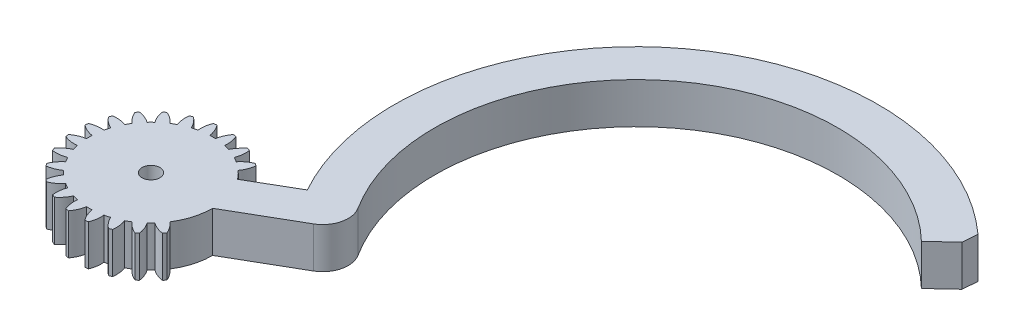
from build123d import *

# Parameters (mm, degrees)
CROQUIS1_R              = 1.75
SALIENTE_EXTRUIR1_DEPTH = 8


with BuildPart() as part:
    # Croquis1 → Saliente-Extruir1 (new body)
    with BuildSketch(Plane(origin=(0, 0, 0), x_dir=(1, 0, 0), z_dir=(0, 1, 0))):
        with BuildLine():
            ThreePointArc((26.318983455, 14.228225469), (34.708358258, 66.001642936), (87.111019212, 63.804032696))
            Line((87.111019212, 63.804032696), (91.223264764, 67.638763711))
            Line((91.223264764, 67.638763711), (91.448573923, 70.544764206))
            ThreePointArc((91.448573923, 70.544764206), (30.189185372, 72.489467715), (18.249404228, 12.373445028))
            Line((18.249404228, 12.373445028), (9.60277667, 7.349917196))
            ThreePointArc((9.60277667, 7.349917196), (8.915528014, 8.169942644), (8.158486898, 8.926012217))
            ThreePointArc((8.158486898, 8.926012217), (8.809805691, 10.105820521), (9.148703928, 11.410163953))
            ThreePointArc((9.148703928, 11.410163953), (8.903135899, 11.602792602), (8.65351323, 11.79013714))
            ThreePointArc((8.65351323, 11.79013714), (7.48132754, 11.125197659), (6.510293938, 10.190715157))
            ThreePointArc((6.510293938, 10.190715157), (6.046375, 10.472628702), (5.57027124, 10.733437515))
            ThreePointArc((5.57027124, 10.733437515), (5.894040025, 12.041618533), (5.883801663, 13.389230859))
            ThreePointArc((5.883801663, 13.389230859), (5.596745198, 13.511738163), (5.30713988, 13.62809199))
            ThreePointArc((5.30713988, 13.62809199), (4.382711316, 12.654251603), (3.650909885, 11.528463019))
            ThreePointArc((3.650909885, 11.528463019), (3.129834008, 11.680699536), (2.602450802, 11.809396783))
            ThreePointArc((2.602450802, 11.809396783), (2.576605271, 13.156800143), (2.217928037, 14.455843809))
            ThreePointArc((2.217928037, 14.455843809), (1.908945561, 14.499881098), (1.599093719, 14.537314892))
            ThreePointArc((1.599093719, 14.537314892), (0.916420874, 13.375367565), (0.542722358, 12.080565177))
            ThreePointArc((0.542722358, 12.080565177), (0, 12.09275), (-0.542722358, 12.080565177))
            ThreePointArc((-0.542722358, 12.080565177), (-0.916420874, 13.375367565), (-1.599093719, 14.537314892))
            ThreePointArc((-1.599093719, 14.537314892), (-1.908945561, 14.499881098), (-2.217928037, 14.455843809))
            ThreePointArc((-2.217928037, 14.455843809), (-2.576605271, 13.156800143), (-2.602450802, 11.809396783))
            ThreePointArc((-2.602450802, 11.809396783), (-3.129834008, 11.680699536), (-3.650909885, 11.528463019))
            ThreePointArc((-3.650909885, 11.528463019), (-4.346994451, 12.682425791), (-5.30713988, 13.62809199))
            ThreePointArc((-5.30713988, 13.62809199), (-5.596745198, 13.511738163), (-5.883801663, 13.389230859))
            ThreePointArc((-5.883801663, 13.389230859), (-5.894040025, 12.041618533), (-5.57027124, 10.733437515))
            ThreePointArc((-5.57027124, 10.733437515), (-6.046375, 10.472628702), (-6.510293938, 10.190715157))
            ThreePointArc((-6.510293938, 10.190715157), (-7.48132754, 11.125197659), (-8.65351323, 11.79013714))
            ThreePointArc((-8.65351323, 11.79013714), (-8.903135899, 11.602792602), (-9.148703928, 11.410163953))
            ThreePointArc((-9.148703928, 11.410163953), (-8.809805691, 10.105820521), (-8.158486898, 8.926012217))
            ThreePointArc((-8.158486898, 8.926012217), (-8.550865528, 8.550865528), (-8.926012217, 8.158486898))
            ThreePointArc((-8.926012217, 8.158486898), (-10.105820521, 8.809805691), (-11.410163953, 9.148703928))
            ThreePointArc((-11.410163953, 9.148703928), (-11.602792602, 8.903135899), (-11.79013714, 8.65351323))
            ThreePointArc((-11.79013714, 8.65351323), (-11.125197659, 7.48132754), (-10.190715157, 6.510293938))
            ThreePointArc((-10.190715157, 6.510293938), (-10.472628702, 6.046375), (-10.733437515, 5.57027124))
            ThreePointArc((-10.733437515, 5.57027124), (-12.041618533, 5.894040025), (-13.389230859, 5.883801663))
            ThreePointArc((-13.389230859, 5.883801663), (-13.511738163, 5.596745198), (-13.62809199, 5.30713988))
            ThreePointArc((-13.62809199, 5.30713988), (-12.682425791, 4.346994451), (-11.528463019, 3.650909885))
            ThreePointArc((-11.528463019, 3.650909885), (-11.680699536, 3.129834008), (-11.809396783, 2.602450802))
            ThreePointArc((-11.809396783, 2.602450802), (-13.156800143, 2.576605271), (-14.455843809, 2.217928037))
            ThreePointArc((-14.455843809, 2.217928037), (-14.499881098, 1.908945561), (-14.537314892, 1.599093719))
            ThreePointArc((-14.537314892, 1.599093719), (-13.375367565, 0.916420874), (-12.080565177, 0.542722358))
            ThreePointArc((-12.080565177, 0.542722358), (-12.09275, 0), (-12.080565177, -0.542722358))
            ThreePointArc((-12.080565177, -0.542722358), (-13.375367565, -0.916420874), (-14.537314892, -1.599093719))
            ThreePointArc((-14.537314892, -1.599093719), (-14.499881098, -1.908945561), (-14.455843809, -2.217928037))
            ThreePointArc((-14.455843809, -2.217928037), (-13.156800143, -2.576605271), (-11.809396783, -2.602450802))
            ThreePointArc((-11.809396783, -2.602450802), (-11.680699536, -3.129834008), (-11.528463019, -3.650909885))
            ThreePointArc((-11.528463019, -3.650909885), (-12.682425791, -4.346994451), (-13.62809199, -5.30713988))
            ThreePointArc((-13.62809199, -5.30713988), (-13.511738163, -5.596745198), (-13.389230859, -5.883801663))
            ThreePointArc((-13.389230859, -5.883801663), (-12.041618533, -5.894040025), (-10.733437515, -5.57027124))
            ThreePointArc((-10.733437515, -5.57027124), (-10.472628702, -6.046375), (-10.190715157, -6.510293938))
            ThreePointArc((-10.190715157, -6.510293938), (-11.125197659, -7.48132754), (-11.79013714, -8.65351323))
            ThreePointArc((-11.79013714, -8.65351323), (-11.602792602, -8.903135899), (-11.410163953, -9.148703928))
            ThreePointArc((-11.410163953, -9.148703928), (-10.105820521, -8.809805691), (-8.926012217, -8.158486898))
            ThreePointArc((-8.926012217, -8.158486898), (-8.550865528, -8.550865528), (-8.158486898, -8.926012217))
            ThreePointArc((-8.158486898, -8.926012217), (-8.809805691, -10.105820521), (-9.148703928, -11.410163953))
            ThreePointArc((-9.148703928, -11.410163953), (-8.903135899, -11.602792602), (-8.65351323, -11.79013714))
            ThreePointArc((-8.65351323, -11.79013714), (-7.48132754, -11.125197659), (-6.510293938, -10.190715157))
            ThreePointArc((-6.510293938, -10.190715157), (-6.046375, -10.472628702), (-5.57027124, -10.733437515))
            ThreePointArc((-5.57027124, -10.733437515), (-5.894040025, -12.041618533), (-5.883801663, -13.389230859))
            ThreePointArc((-5.883801663, -13.389230859), (-5.596745198, -13.511738163), (-5.30713988, -13.62809199))
            ThreePointArc((-5.30713988, -13.62809199), (-4.346994451, -12.682425791), (-3.650909885, -11.528463019))
            ThreePointArc((-3.650909885, -11.528463019), (-3.129834008, -11.680699536), (-2.602450802, -11.809396783))
            ThreePointArc((-2.602450802, -11.809396783), (-2.576605271, -13.156800143), (-2.217928037, -14.455843809))
            ThreePointArc((-2.217928037, -14.455843809), (-1.908945561, -14.499881098), (-1.599093719, -14.537314892))
            ThreePointArc((-1.599093719, -14.537314892), (-0.916420874, -13.375367565), (-0.542722358, -12.080565177))
            ThreePointArc((-0.542722358, -12.080565177), (0, -12.09275), (0.542722358, -12.080565177))
            ThreePointArc((0.542722358, -12.080565177), (0.916420874, -13.375367565), (1.599093719, -14.537314892))
            ThreePointArc((1.599093719, -14.537314892), (1.908945561, -14.499881098), (2.217928037, -14.455843809))
            ThreePointArc((2.217928037, -14.455843809), (2.576605271, -13.156800143), (2.602450802, -11.809396783))
            ThreePointArc((2.602450802, -11.809396783), (3.129834008, -11.680699536), (3.650909885, -11.528463019))
            ThreePointArc((3.650909885, -11.528463019), (4.346994451, -12.682425791), (5.30713988, -13.62809199))
            ThreePointArc((5.30713988, -13.62809199), (5.596745198, -13.511738163), (5.883801663, -13.389230859))
            ThreePointArc((5.883801663, -13.389230859), (5.894040025, -12.041618533), (5.57027124, -10.733437515))
            ThreePointArc((5.57027124, -10.733437515), (6.046375, -10.472628702), (6.510293938, -10.190715157))
            ThreePointArc((6.510293938, -10.190715157), (7.48132754, -11.125197659), (8.65351323, -11.79013714))
            ThreePointArc((8.65351323, -11.79013714), (8.903135899, -11.602792602), (9.148703928, -11.410163953))
            ThreePointArc((9.148703928, -11.410163953), (8.809805691, -10.105820521), (8.158486898, -8.926012217))
            ThreePointArc((8.158486898, -8.926012217), (8.550865528, -8.550865528), (8.926012217, -8.158486898))
            ThreePointArc((8.926012217, -8.158486898), (10.105820521, -8.809805691), (11.410163953, -9.148703928))
            ThreePointArc((11.410163953, -9.148703928), (11.602792602, -8.903135899), (11.79013714, -8.65351323))
            ThreePointArc((11.79013714, -8.65351323), (11.125197659, -7.48132754), (10.190715157, -6.510293938))
            ThreePointArc((10.190715157, -6.510293938), (10.472628702, -6.046375), (10.733437515, -5.57027124))
            ThreePointArc((10.733437515, -5.57027124), (11.748007896, -2.866864669), (12.09275, 0))
            Line((12.09275, 0), (24.597080908, 7.219378816))
            ThreePointArc((24.597080908, 7.219378816), (26.952693775, 10.356600271), (26.318983455, 14.228225469))
        make_face()
        with Locations(Location((0, 0, 0), (0, 0, 270))):
            Circle(CROQUIS1_R, mode=Mode.SUBTRACT)
    extrude(amount=SALIENTE_EXTRUIR1_DEPTH)


solid = part.part
